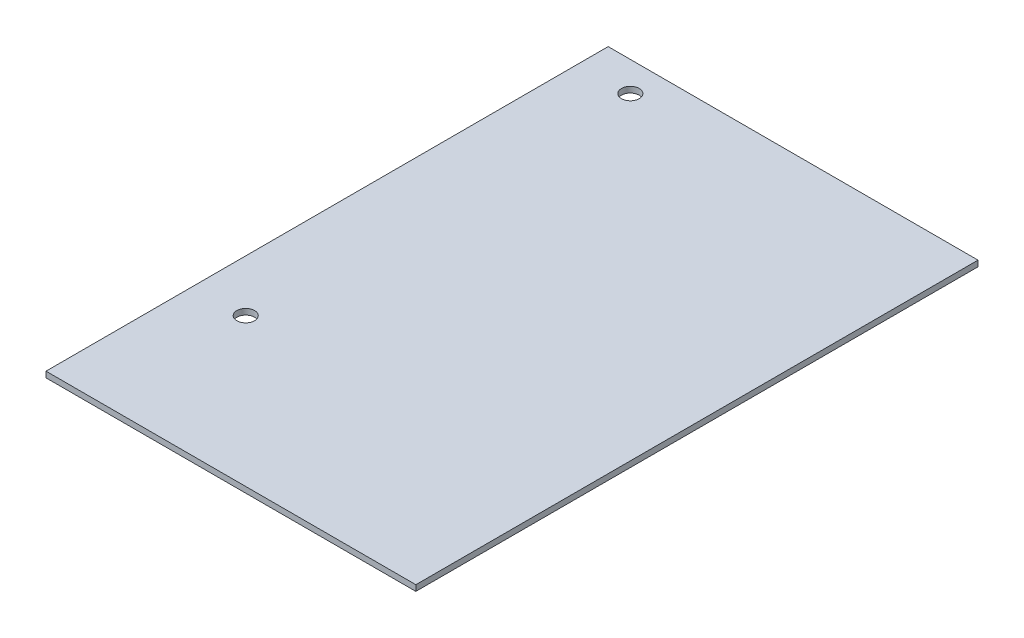
from build123d import *

# Parameters (mm, degrees)
SKETCH1_W              = 63.5
SKETCH1_H              = 96.52
BOSS_EXTRUDE1_DEPTH    = 1
SKETCH2_R              = 1.524
MOUNTING_HOLES_1_DEPTH = 2
SKETCH3_R              = 1.524
MOUNTING_HOLES_2_DEPTH = 3


with BuildPart() as part:
    # Sketch1 → Boss-Extrude1 (new body)
    with BuildSketch(Plane(origin=(0, 0, 0), x_dir=(1, 0, 0), z_dir=(0, 1, 0))):
        with Locations((31.75, 48.26)):
            Rectangle(SKETCH1_W, SKETCH1_H)
    extrude(amount=BOSS_EXTRUDE1_DEPTH)

    # Sketch2 → mounting holes (1) (cut)
    with BuildSketch(Plane(origin=(0, 1, 0), x_dir=(1, 0, 0), z_dir=(0, 1, 0))):
        with Locations(Location((8.89, 91.44, 0), (0, 0, 270))):
            Circle(SKETCH2_R)
    extrude(amount=-MOUNTING_HOLES_1_DEPTH, mode=Mode.SUBTRACT)

    # Sketch3 → mounting holes (2) (cut)
    with BuildSketch(Plane(origin=(0, 1, 0), x_dir=(1, 0, 0), z_dir=(0, 1, 0))):
        with Locations(Location((8.89, 25.4, 0), (0, 0, 270))):
            Circle(SKETCH3_R)
    extrude(amount=-MOUNTING_HOLES_2_DEPTH, mode=Mode.SUBTRACT)


solid = part.part
